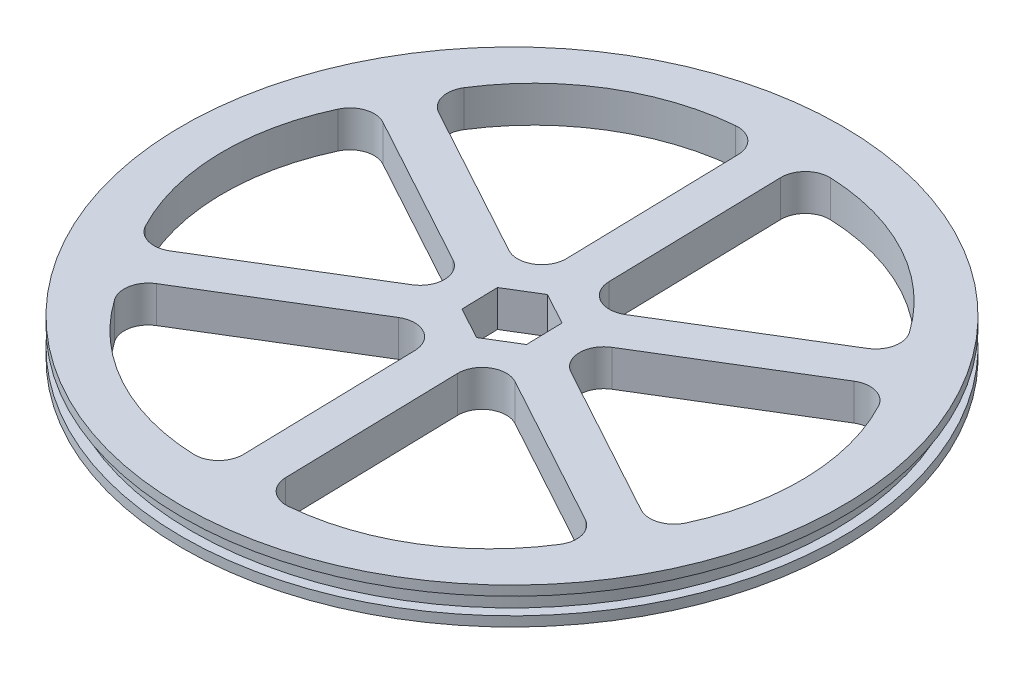
from build123d import *

# Parameters (mm, degrees)
SKETCH1_R                = 66
BOSS_EXTRUDE1_DEPTH      = 7.5
SKETCH1_4_R              = 68
SKETCH1_4_R_2            = 66
BOSS_EXTRUDE3_DEPTH      = 2
BOSS_EXTRUDE4_START      = -2
SKETCH4_R                = 68
BOSS_EXTRUDE4_DEPTH      = 2
CUT_EXTRUDE1_DEPTH       = 97.458540317
CUT_EXTRUDE2_DEPTH       = 97.458540317
FILLET1_R                = 5
CIRPATTERN1_COUNT        = 6
FILLET1_OF_CIRPATTERN1_R = 5


with BuildPart() as part:
    # Sketch1 → Boss-Extrude1 (new body)
    with BuildSketch(Plane(origin=(0, 0, 0), x_dir=(1, 0, 0), z_dir=(0, 1, 0))):
        Circle(SKETCH1_R)
    extrude(amount=BOSS_EXTRUDE1_DEPTH)

    # Sketch1<4> → Boss-Extrude3 (add)
    with BuildSketch(Plane(origin=(0, 0, 0), x_dir=(1, 0, 0), z_dir=(0, 1, 0))):
        Circle(SKETCH1_4_R)
        Circle(SKETCH1_4_R_2, mode=Mode.SUBTRACT)
    extrude(amount=BOSS_EXTRUDE3_DEPTH)

    # Sketch4 → Boss-Extrude4 (add)
    with BuildSketch(Plane(origin=(0, 7.5, 0), x_dir=(1, 0, 0), z_dir=(0, 1, 0)).offset(BOSS_EXTRUDE4_START)):
        Circle(SKETCH4_R)
    extrude(amount=BOSS_EXTRUDE4_DEPTH)

    # Sketch6 → Cut-Extrude1 (cut, through all)
    with BuildSketch(Plane(origin=(0, 7.5, 0), x_dir=(1, 0, 0), z_dir=(0, 1, 0))):
        Polygon((-6.589092189, 3.594050285), (-6.407084944, -3.909296081), (0.182007245, -7.503346367), (6.589092189, -3.594050285), (6.407084944, 3.909296081), (-0.182007245, 7.503346367), align=None)
    extrude(amount=-CUT_EXTRUDE1_DEPTH, mode=Mode.SUBTRACT)

    # Sketch7 → Cut-Extrude2 (cut, through all)
    with BuildSketch(Plane(origin=(0, 7.5, 0), x_dir=(1, 0, 0), z_dir=(0, 1, 0))):
        with BuildLine():
            Line((-4.427257323, 7.255990118), (-48.322035968, 31.198596652))
            ThreePointArc((-48.322035968, 31.198596652), (-30.84284899, 50.549446572), (-5.639741154, 57.241286786))
            Line((-5.639741154, 57.241286786), (-4.427257323, 7.255990118))
        make_face()
    cut_extrude2 = extrude(amount=-CUT_EXTRUDE2_DEPTH, mode=Mode.SUBTRACT)

    # Fillet1
    fillet1_edges = [part.edges().sort_by_distance(p)[0] for p in [
        (-4.427257323, 3.75, -7.255990118),
        (-5.639741154, 3.75, -57.241286786),
        (-48.322035968, 3.75, -31.198596652),
    ]]
    fillet(fillet1_edges, radius=FILLET1_R)

    # CirPattern1: Cut-Extrude2 ×6 about axis
    cirpattern1_axis = Axis((0, 0, 0), (0, 1, 0))
    for i in range(1, CIRPATTERN1_COUNT):
        add(cut_extrude2.rotate(cirpattern1_axis, i * 360 / CIRPATTERN1_COUNT), mode=Mode.SUBTRACT)

    # Fillet1 of CirPattern1
    fillet1_of_cirpattern1_edges = [part.edges().sort_by_distance(p)[0] for p in [
        (-8.497500434, 3.75, 0.206122251),
        (-52.392279079, 3.75, -23.736484283),
        (-51.179795248, 3.75, 26.248812385),
        (-4.070243111, 3.75, 7.46211237),
        (-46.752537925, 3.75, 33.504802503),
        (-2.857759279, 3.75, 57.447409037),
        (4.427257323, 3.75, 7.255990118),
        (5.639741154, 3.75, 57.241286786),
        (48.322035968, 3.75, 31.198596652),
        (8.497500434, 3.75, -0.206122251),
        (52.392279079, 3.75, 23.736484283),
        (51.179795248, 3.75, -26.248812385),
        (4.070243111, 3.75, -7.46211237),
        (46.752537925, 3.75, -33.504802503),
        (2.857759279, 3.75, -57.447409037),
    ]]
    fillet(fillet1_of_cirpattern1_edges, radius=FILLET1_OF_CIRPATTERN1_R)


solid = part.part
